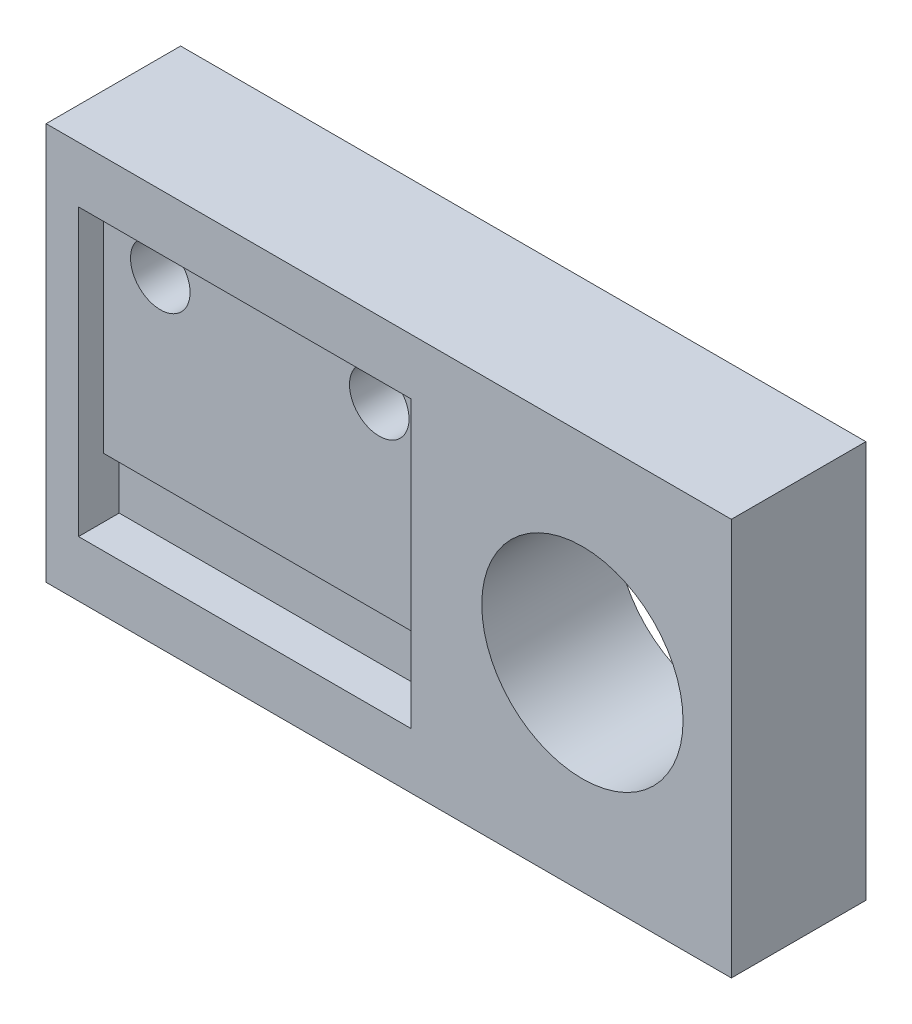
from build123d import *
from build123d.topology import SkipClean

# Parameters (mm, degrees)
SKETCH1_W           = 43.815
SKETCH1_H           = 25.4
SKETCH1_R           = 1.9039967
SKETCH1_R_2         = 6.435
BOSS_EXTRUDE1_DEPTH = 4.000000064
SKETCH2_W           = 43.815
SKETCH2_H           = 25.4
SKETCH2_R           = 6.435
SKETCH2_W_2         = 21.254
SKETCH2_H_2         = 18.254
BOSS_EXTRUDE2_DEPTH = 1.6
BOSS_EXTRUDE3_START = 3
SKETCH3_W           = 43.815
SKETCH3_H           = 25.4
SKETCH3_R           = 6.435
BOSS_EXTRUDE3_DEPTH = 3
SKETCH5_W           = 21.254
SKETCH5_H           = 3.81
CUT_EXTRUDE1_DEPTH  = 1


with BuildPart() as part:
    # Sketch1 → Boss-Extrude1 (new body)
    with BuildSketch(Plane.XY):
        with Locations((21.9075, 12.7)):
            Rectangle(SKETCH1_W, SKETCH1_H)
        with Locations((5.7, 19.05)):
            Circle(SKETCH1_R, mode=Mode.SUBTRACT)
        with Locations((19.7, 19.05)):
            Circle(SKETCH1_R, mode=Mode.SUBTRACT)
        with Locations((34.29, 12.7)):
            Circle(SKETCH1_R_2, mode=Mode.SUBTRACT)
    extrude(amount=BOSS_EXTRUDE1_DEPTH)

    # Sketch2 → Boss-Extrude2 (add)
    with BuildSketch(Plane.XY.offset(4.000000064)):
        with Locations((21.9075, 12.7)):
            Rectangle(SKETCH2_W, SKETCH2_H)
        with Locations((34.29, 12.7)):
            Circle(SKETCH2_R, mode=Mode.SUBTRACT)
        with Locations((12.7, 12.7)):
            Rectangle(SKETCH2_W_2, SKETCH2_H_2, mode=Mode.SUBTRACT)
    extrude(amount=BOSS_EXTRUDE2_DEPTH)

    # Sketch3 → Boss-Extrude3 (add)
    with SkipClean():  # the faces are left unmerged after this step: merging them gives an invalid solid
        with BuildSketch(Plane(origin=(0, 0, 0), x_dir=(-1, 0, 0), z_dir=(0, 0, -1)).offset(BOSS_EXTRUDE3_START)):
            with Locations((-21.9075, 12.7)):
                Rectangle(SKETCH3_W, SKETCH3_H)
            with Locations((-34.29, 12.7)):
                Circle(SKETCH3_R, mode=Mode.SUBTRACT)
            Polygon((-16.5690055, 17.242319483), (-16.5690055, 20.857680517), (-19.7, 22.665361035), (-22.8309945, 20.857680517), (-22.8309945, 17.242319483), (-19.7, 15.434638965), align=None, mode=Mode.SUBTRACT)
            Polygon((-2.5690055, 20.857680517), (-5.7, 22.665361035), (-8.8309945, 20.857680517), (-8.8309945, 17.242319483), (-5.7, 15.434638965), (-2.5690055, 17.242319483), align=None, mode=Mode.SUBTRACT)
        extrude(amount=-BOSS_EXTRUDE3_DEPTH)

    # Sketch5 → Cut-Extrude1 (cut)
    with SkipClean():  # the faces are left unmerged after this step: merging them gives an invalid solid
        with BuildSketch(Plane.XY.offset(4.000000064)):
            with Locations((12.7, 5.478)):
                Rectangle(SKETCH5_W, SKETCH5_H)
        extrude(amount=-CUT_EXTRUDE1_DEPTH, mode=Mode.SUBTRACT)


solid = part.part
